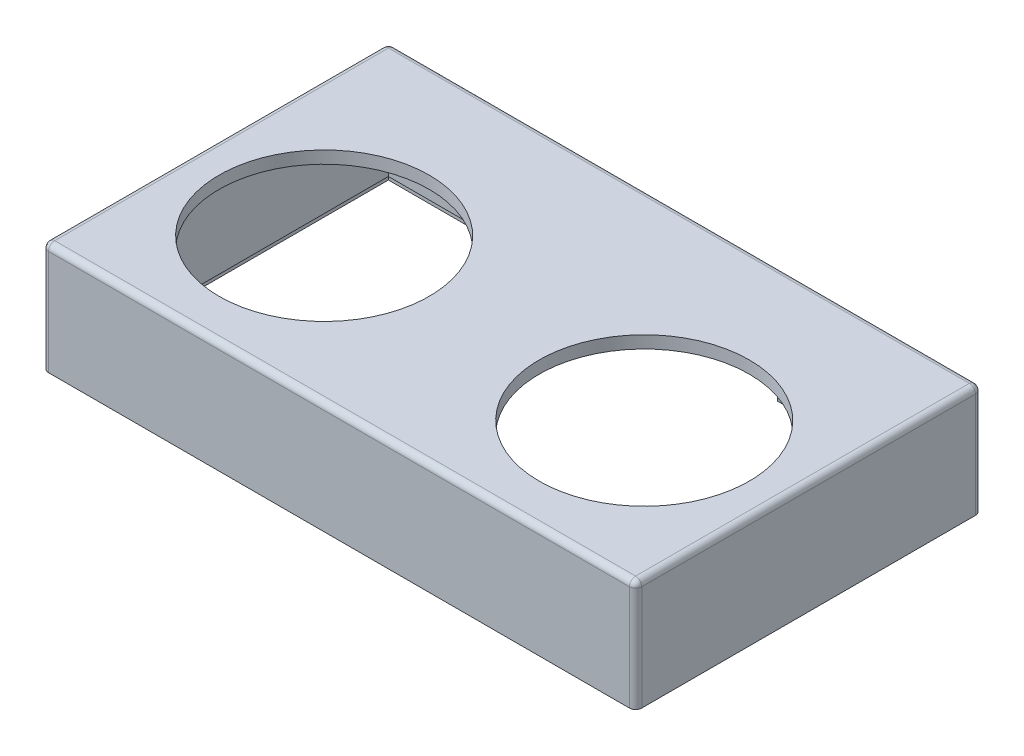
from build123d import *

# Parameters (mm, degrees)
SKETCH1_W           = 48
SKETCH1_H           = 28
BOSS_EXTRUDE1_DEPTH = 9
SKETCH2_W           = 45
SKETCH2_H           = 25
CUT_EXTRUDE1_DEPTH  = 8
SKETCH3_R           = 8.5
CUT_EXTRUDE2_DEPTH  = 22
SKETCH4_W           = 46.5
SKETCH4_H           = 26.5
CUT_EXTRUDE3_DEPTH  = 1
SKETCH10_W          = 8
SKETCH10_H          = 3.5
CUT_EXTRUDE4_DEPTH  = 30.206163733
FILLET5_R           = 0.5


with BuildPart() as part:
    # Sketch1 → Boss-Extrude1 (new body)
    with BuildSketch(Plane(origin=(0, 0, 0), x_dir=(1, 0, 0), z_dir=(0, 1, 0))):
        Rectangle(SKETCH1_W, SKETCH1_H)
    extrude(amount=BOSS_EXTRUDE1_DEPTH)

    # Sketch2 → Cut-Extrude1 (cut)
    with BuildSketch(Plane.XZ):
        Rectangle(SKETCH2_W, SKETCH2_H)
    extrude(amount=-CUT_EXTRUDE1_DEPTH, mode=Mode.SUBTRACT)

    # Sketch3 → Cut-Extrude2 (cut)
    with BuildSketch(Plane(origin=(0, 9, 0), x_dir=(1, 0, 0), z_dir=(0, 1, 0))):
        with Locations(Location((-12.95, -2.25, 0), (0, 0, 270))):
            Circle(SKETCH3_R)
        with Locations(Location((12.95, -2.25, 0), (0, 0, 270))):
            Circle(SKETCH3_R)
    extrude(amount=-CUT_EXTRUDE2_DEPTH, mode=Mode.SUBTRACT)

    # Sketch4 → Cut-Extrude3 (cut)
    with BuildSketch(Plane.XZ):
        Rectangle(SKETCH4_W, SKETCH4_H)
    extrude(amount=-CUT_EXTRUDE3_DEPTH, mode=Mode.SUBTRACT)

    # Sketch10 → Cut-Extrude4 (cut, through all)
    with BuildSketch(Plane.XY):
        with Locations((5, 1.75)):
            Rectangle(SKETCH10_W, SKETCH10_H)
    extrude(amount=-CUT_EXTRUDE4_DEPTH, mode=Mode.SUBTRACT)

    # Fillet5
    fillet5_edges = [part.edges().sort_by_distance(p)[0] for p in [
        (-24, 9, 0),
        (0, 9, 14),
        (24, 9, 0),
        (0, 9, -14),
        (24, 4.5, 14),
        (-24, 4.5, 14),
        (-24, 4.5, -14),
        (24, 4.5, -14),
    ]]
    fillet(fillet5_edges, radius=FILLET5_R)


solid = part.part
